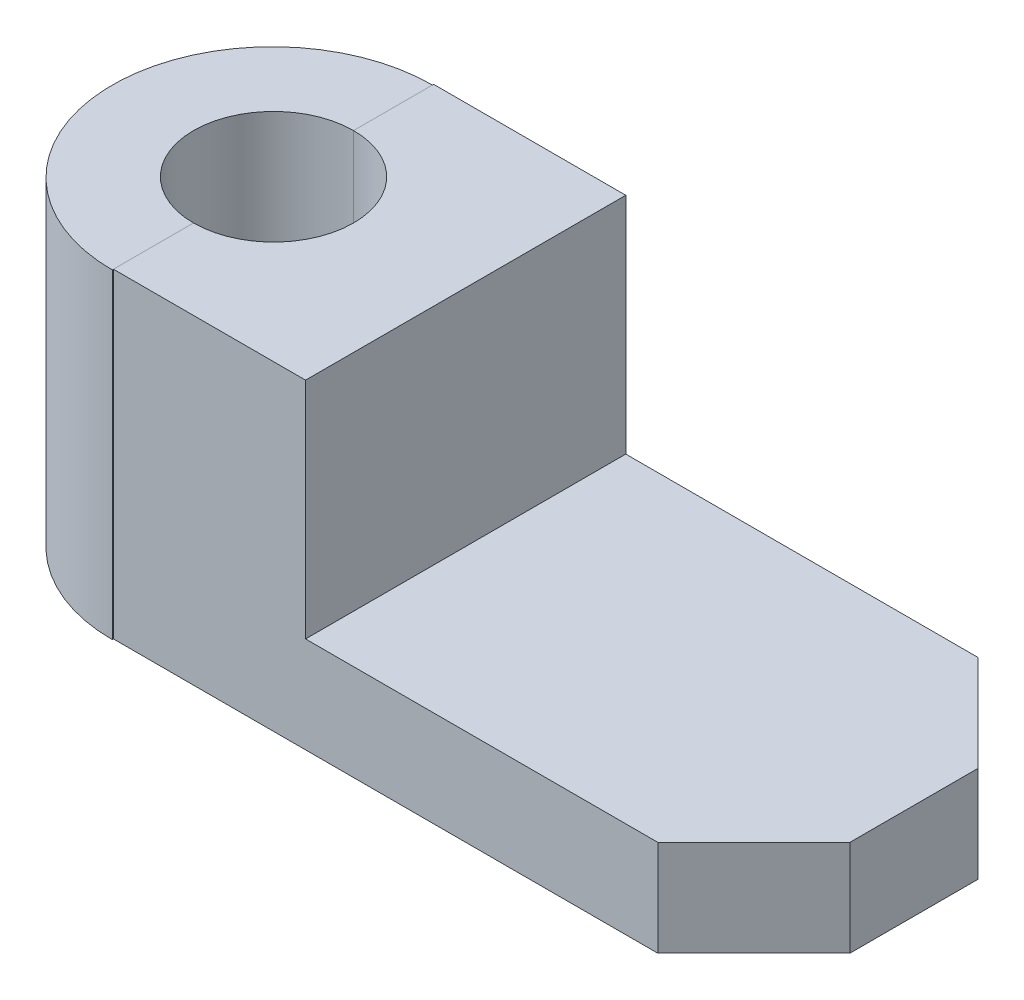
from build123d import *

# Parameters (mm, degrees)
BOSS_EXTRUDE1_DEPTH      = 15
BOSS_EXTRUDE1_DEPTH_BACK = 15
BOSS_EXTRUDE2_DEPTH      = 30
CHAMFER1_SIZE            = 9
CHAMFER2_SIZE            = 9
SKETCH3_R                = 7.5
CUT_EXTRUDE2_DEPTH       = 54.780246911


with BuildPart() as part:
    # Sketch1 → Boss-Extrude1 (new, two sides: drawn at the far end of the back side and taken through both)
    with BuildSketch(Plane.XY.offset(-BOSS_EXTRUDE1_DEPTH_BACK)):
        Polygon((-18, 30), (0, 30), (0, 9), (42, 9), (42, 0), (0, 0), (-18, 0), align=None)
    extrude(amount=BOSS_EXTRUDE1_DEPTH + BOSS_EXTRUDE1_DEPTH_BACK)

    # Chamfer1
    chamfer1_edges = [part.edges().sort_by_distance(p)[0] for p in [
        (42, 4.5, 15),
    ]]
    chamfer(chamfer1_edges, length=CHAMFER1_SIZE)

    # Chamfer2
    chamfer2_edges = [part.edges().sort_by_distance(p)[0] for p in [
        (42, 4.5, -15),
    ]]
    chamfer(chamfer2_edges, length=CHAMFER2_SIZE)


with BuildPart() as body_2:
    # Sketch2 → Boss-Extrude2 (new body)
    with BuildSketch(Plane(origin=(0, 30, 0), x_dir=(1, 0, 0), z_dir=(0, 1, 0))):
        with BuildLine():
            Line((-18, 14.889905433), (-18, -15.110094567))
            ThreePointArc((-18, -15.110094567), (-33, -0.110094567), (-18, 14.889905433))
        make_face()
    extrude(amount=-BOSS_EXTRUDE2_DEPTH)


with BuildPart() as cut_extrude2_tool:
    # Sketch3 → Cut-Extrude2 (new, through all)
    with BuildSketch(Plane(origin=(0, 30, 0), x_dir=(1, 0, 0), z_dir=(0, 1, 0))):
        with Locations((-18, 0)):
            Circle(SKETCH3_R)
    extrude(amount=-CUT_EXTRUDE2_DEPTH)


with BuildPart() as part_1:
    add(part.part)

    # Cut-Extrude2: cut by cut_extrude2_tool
    add(cut_extrude2_tool.part, mode=Mode.SUBTRACT)


with BuildPart() as body_2_1:
    add(body_2.part)

    # Cut-Extrude2: cut by cut_extrude2_tool
    add(cut_extrude2_tool.part, mode=Mode.SUBTRACT)


solid = Compound([part_1.part, body_2_1.part])
